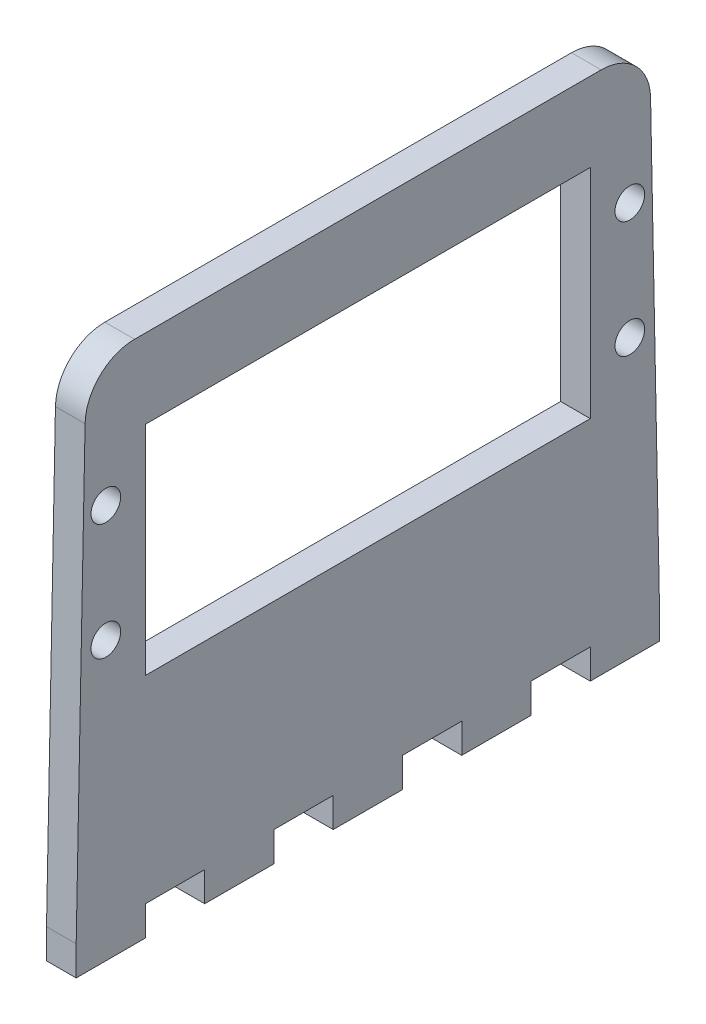
from build123d import *

# Parameters (mm, degrees)
SKETCH1_R           = 1.5
SKETCH1_W           = 45
SKETCH1_H           = 22
BOSS_EXTRUDE1_DEPTH = 3
FILLET1_R           = 5


with BuildPart() as part:
    # Sketch1 → Boss-Extrude1 (new body)
    with BuildSketch(Plane(origin=(0, 0, 0), x_dir=(0, 0, -1), z_dir=(1, 0, 0))):
        Polygon((-33, 0), (-32, 50), (25, 50), (26, 0), (26, -3), (19, -3), (19, 0), (13, 0), (13, -3), (6, -3), (6, 0), (0, 0), (0, -3), (-7, -3), (-7, 0), (-13, 0), (-13, -3), (-20, -3), (-20, 0), (-26, 0), (-26, -3), (-33, -3), align=None)
        with Locations((23, 36.9)):
            Circle(SKETCH1_R, mode=Mode.SUBTRACT)
        with Locations(Location((23, 25.1, 0), (0, 0, 180))):
            Circle(SKETCH1_R, mode=Mode.SUBTRACT)
        with Locations(Location((-30, 36.9, 0), (0, 0, 180))):
            Circle(SKETCH1_R, mode=Mode.SUBTRACT)
        with Locations((-30, 25.1)):
            Circle(SKETCH1_R, mode=Mode.SUBTRACT)
        with Locations((-3.5, 31)):
            Rectangle(SKETCH1_W, SKETCH1_H, mode=Mode.SUBTRACT)
    extrude(amount=BOSS_EXTRUDE1_DEPTH)

    # Fillet1
    fillet1_edges = [part.edges().sort_by_distance(p)[0] for p in [
        (1.5, 50, 32),
        (1.5, 50, -25),
    ]]
    fillet(fillet1_edges, radius=FILLET1_R)


solid = part.part
